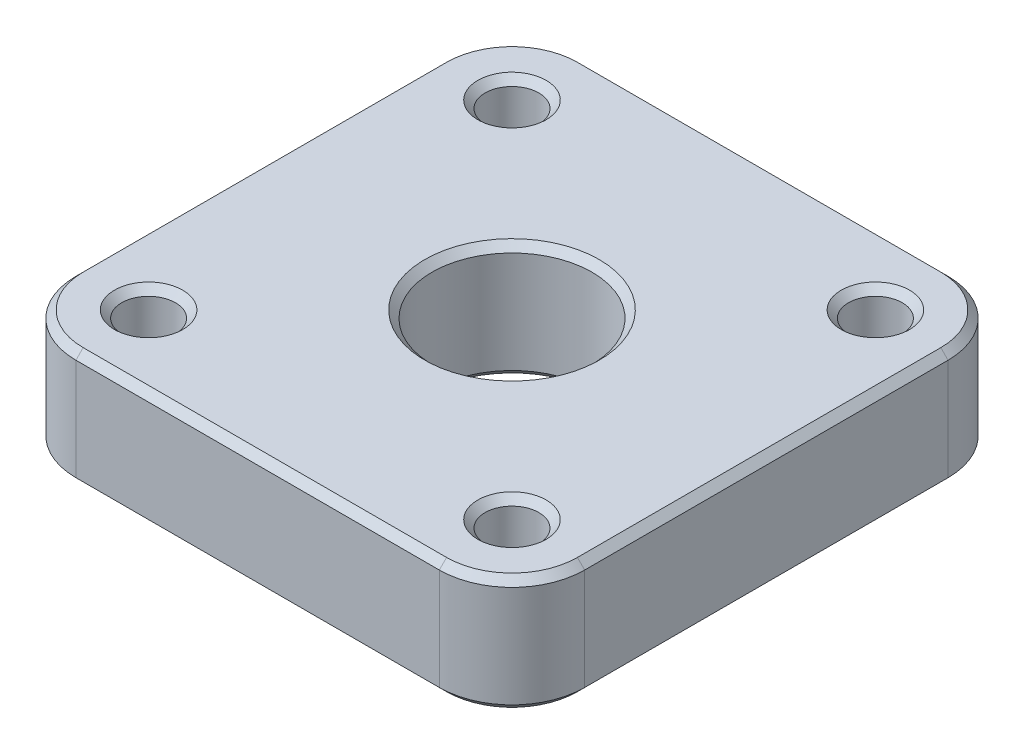
from build123d import *

# Parameters (mm, degrees)
SKETCH_1_W          = 70
SKETCH_1_H          = 70
EXTRUDE_1_DEPTH     = 16
SKETCH_2_R          = 11
SKETCH_2_R_2        = 3.7
CUT_EXTRUDE_1_DEPTH = 53.019227215
FILLET_1_R          = 10
CHAMFER_1_SIZE      = 1


with BuildPart() as part:
    # Эскиз1 → Бобышка-Вытянуть1 (new body)
    with BuildSketch(Plane(origin=(0, 0, 0), x_dir=(1, 0, 0), z_dir=(0, 1, 0))):
        Rectangle(SKETCH_1_W, SKETCH_1_H)
    extrude(amount=EXTRUDE_1_DEPTH)

    # Эскиз2 → Вырез-Вытянуть1 (cut, through all)
    with BuildSketch(Plane(origin=(0, 16, 0), x_dir=(1, 0, 0), z_dir=(0, 1, 0))):
        with Locations(Location((0, 0, 0), (0, 0, 270))):
            Circle(SKETCH_2_R)
        with Locations(Location((-25, 25, 0), (0, 0, 270))):
            Circle(SKETCH_2_R_2)
        with Locations(Location((25, 25, 0), (0, 0, 270))):
            Circle(SKETCH_2_R_2)
        with Locations(Location((25, -25, 0), (0, 0, 270))):
            Circle(SKETCH_2_R_2)
        with Locations(Location((-25, -25, 0), (0, 0, 270))):
            Circle(SKETCH_2_R_2)
    extrude(amount=-CUT_EXTRUDE_1_DEPTH, mode=Mode.SUBTRACT)

    # Скругление1
    fillet_1_edges = [part.edges().sort_by_distance(p)[0] for p in [
        (35, 8, 35),
        (-35, 8, 35),
        (-35, 8, -35),
        (35, 8, -35),
    ]]
    fillet(fillet_1_edges, radius=FILLET_1_R)

    # Фаска1
    chamfer_1_edges = [part.edges().sort_by_distance(p)[0] for p in [
        (-25, 0, 21.3),
        (-25, 16, 21.3),
        (25, 0, 21.3),
        (25, 16, 21.3),
        (25, 0, -28.7),
        (25, 16, -28.7),
        (-25, 0, -28.7),
        (-25, 16, -28.7),
        (0, 0, -11),
        (0, 16, -11),
        (0, 0, 35),
        (0, 16, 35),
        (35, 0, 0),
        (-35, 0, 0),
        (0, 0, -35),
        (32.071067812, 0, -32.071067812),
        (32.071067812, 0, 32.071067812),
        (-32.071067812, 0, -32.071067812),
        (-32.071067812, 0, 32.071067812),
        (-35, 16, 0),
        (35, 16, 0),
        (0, 16, -35),
        (32.071067812, 16, -32.071067812),
        (32.071067812, 16, 32.071067812),
        (-32.071067812, 16, -32.071067812),
        (-32.071067812, 16, 32.071067812),
    ]]
    chamfer(chamfer_1_edges, length=CHAMFER_1_SIZE)


solid = part.part
